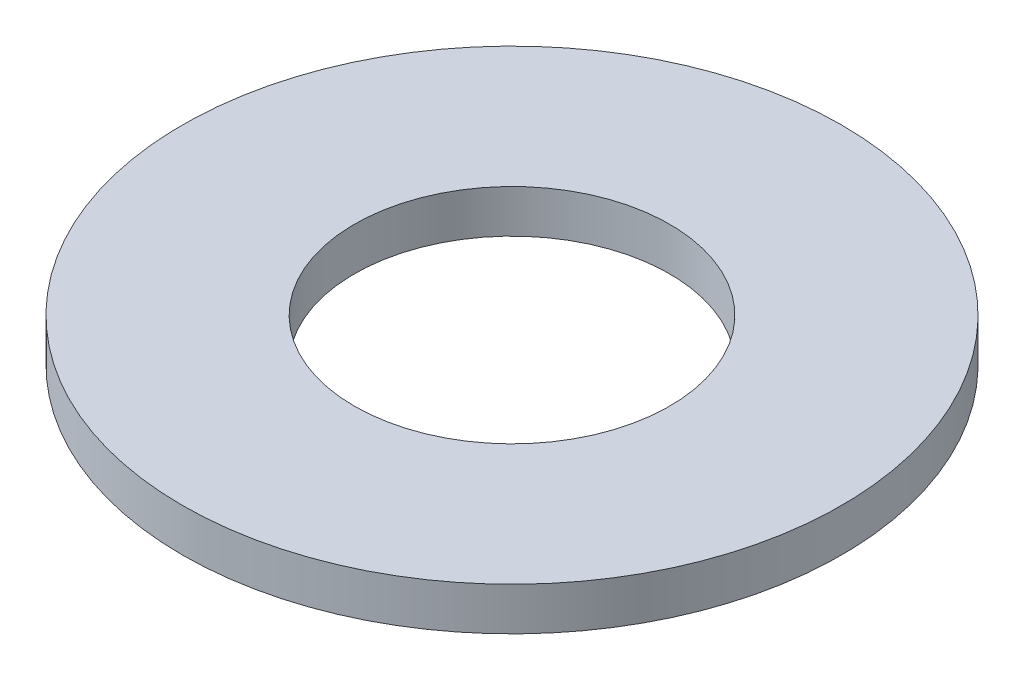
from build123d import *

# Parameters (mm, degrees)
SKETCH1_R           = 23
SKETCH1_R_2         = 11
BOSS_EXTRUDE1_DEPTH = 3


with BuildPart() as part:
    # Sketch1 → Boss-Extrude1 (new body)
    with BuildSketch(Plane(origin=(0, 0, 0), x_dir=(1, 0, 0), z_dir=(0, 1, 0))):
        with Locations(Location((0, 0, 0), (0, 0, 270))):
            Circle(SKETCH1_R)
        with Locations(Location((0, 0, 0), (0, 0, 270))):
            Circle(SKETCH1_R_2, mode=Mode.SUBTRACT)
    extrude(amount=BOSS_EXTRUDE1_DEPTH)


solid = part.part
